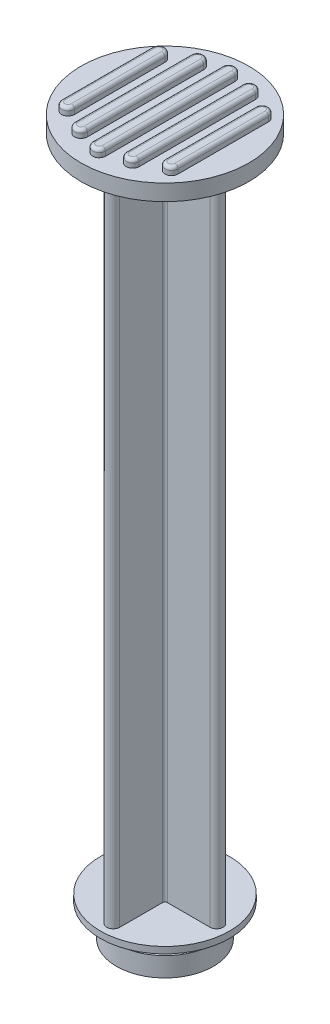
from build123d import *

# Parameters (mm, degrees)
BOSS_EXTRUDE1_DEPTH = 102
SKETCH3_R           = 13
BOSS_EXTRUDE2_DEPTH = 2.5
BOSS_EXTRUDE4_DEPTH = 1.2
FILLET1_R           = 0.5


with BuildPart() as part:
    # Sketch1 → Revolve1 (revolve)
    with BuildSketch(Plane.XY, mode=Mode.PRIVATE) as revolve1_sk:
        Polygon((0, 0), (7.5, 0), (7.5, 3), (6, 3), (6, 5), (10, 5), (10, 6), (0, 6), align=None)
    revolve(revolve1_sk.sketch.rotate(Axis((0, 6, 0), (0, -1, 0)), 90), axis=Axis((0, 6, 0), (0, -1, 0)))

    # Sketch2 → Boss-Extrude1 (add)
    with BuildSketch(Plane(origin=(0, 6, 0), x_dir=(1, 0, 0), z_dir=(0, 1, 0))):
        with BuildLine():
            Line((-1, 8), (-1, 1.377792523))
            ThreePointArc((-1, 1.377792523), (-1.110652868, 1.110652868), (-1.377792523, 1))
            Line((-1.377792523, 1), (-8, 1))
            ThreePointArc((-8, 1), (-9, 0), (-8, -1))
            Line((-8, -1), (-1.377792523, -1))
            ThreePointArc((-1.377792523, -1), (-1.110652868, -1.110652868), (-1, -1.377792523))
            Line((-1, -1.377792523), (-1, -8))
            ThreePointArc((-1, -8), (0, -9), (1, -8))
            Line((1, -8), (1, -1.377792523))
            ThreePointArc((1, -1.377792523), (1.110652868, -1.110652868), (1.377792523, -1))
            Line((1.377792523, -1), (8, -1))
            ThreePointArc((8, -1), (9, 0), (8, 1))
            Line((8, 1), (1.377792523, 1))
            ThreePointArc((1.377792523, 1), (1.110652868, 1.110652868), (1, 1.377792523))
            Line((1, 1.377792523), (1, 8))
            ThreePointArc((1, 8), (0, 9), (-1, 8))
        make_face()
    extrude(amount=BOSS_EXTRUDE1_DEPTH)

    # Sketch3 → Boss-Extrude2 (add)
    with BuildSketch(Plane(origin=(0, 108, 0), x_dir=(1, 0, 0), z_dir=(0, 1, 0))):
        with Locations(Location((0, 0, 0), (0, 0, 270))):
            Circle(SKETCH3_R)
    extrude(amount=BOSS_EXTRUDE2_DEPTH)

    # Sketch4 → Boss-Extrude4 (add)
    with BuildSketch(Plane(origin=(0, 110.5, 0), x_dir=(1, 0, 0), z_dir=(0, 1, 0))):
        with BuildLine():
            ThreePointArc((6.999692348, 7.020465501), (7.999692348, 8.020465501), (8.999692348, 7.020465501))
            Line((8.999692348, 7.020465501), (8.999692348, -6.979534499))
            ThreePointArc((8.999692348, -6.979534499), (7.999692348, -7.979534499), (6.999692348, -6.979534499))
            Line((6.999692348, -6.979534499), (6.999692348, 7.020465501))
        make_face()
        with BuildLine():
            ThreePointArc((2.999705113, 9.015412789), (3.999705113, 10.015412789), (4.999705113, 9.015412789))
            Line((4.999705113, 9.015412789), (4.999705113, -8.984587211))
            ThreePointArc((4.999705113, -8.984587211), (3.999705113, -9.984587211), (2.999705113, -8.984587211))
            Line((2.999705113, -8.984587211), (2.999705113, 9.015412789))
        make_face()
        with BuildLine():
            ThreePointArc((-1, -10.229813095), (0, -11.185968286), (1, -10.229813095))
            Line((1, -10.229813095), (1, 9.859887042))
            ThreePointArc((1, 9.859887042), (0, 10.859887042), (-1, 9.859887042))
            Line((-1, 9.859887042), (-1, -10.140112958))
            Line((-1, -10.140112958), (-1, -10.229813095))
        make_face()
        with BuildLine():
            ThreePointArc((-5, 9), (-4, 10), (-3, 9))
            Line((-3, 9), (-3, -9))
            ThreePointArc((-3, -9), (-4, -10), (-5, -9))
            Line((-5, -9), (-5, 9))
        make_face()
        with BuildLine():
            ThreePointArc((-9, 7), (-8, 8), (-7, 7))
            Line((-7, 7), (-7, -7))
            ThreePointArc((-7, -7), (-8, -8), (-9, -7))
            Line((-9, -7), (-9, 7))
        make_face()
    extrude(amount=BOSS_EXTRUDE4_DEPTH)

    # Fillet1
    fillet1_edges = [part.edges().sort_by_distance(p)[0] for p in [
        (0, 111.7, -10.859887042),
        (-1, 111.7, 0.184963027),
        (0, 111.7, 11.185968286),
        (1, 111.7, 0.184963027),
        (-4, 111.7, -10),
        (-5, 111.7, 0),
        (-4, 111.7, 10),
        (-3, 111.7, 0),
        (-8, 111.7, -8),
        (-9, 111.7, 0),
        (-8, 111.7, 8),
        (-7, 111.7, 0),
        (7.999692348, 111.7, -8.020465501),
        (6.999692348, 111.7, -0.020465501),
        (7.999692348, 111.7, 7.979534499),
        (8.999692348, 111.7, -0.020465501),
        (3.999705113, 111.7, -10.015412789),
        (2.999705113, 111.7, -0.015412789),
        (3.999705113, 111.7, 9.984587211),
        (4.999705113, 111.7, -0.015412789),
    ]]
    fillet(fillet1_edges, radius=FILLET1_R)


solid = part.part
